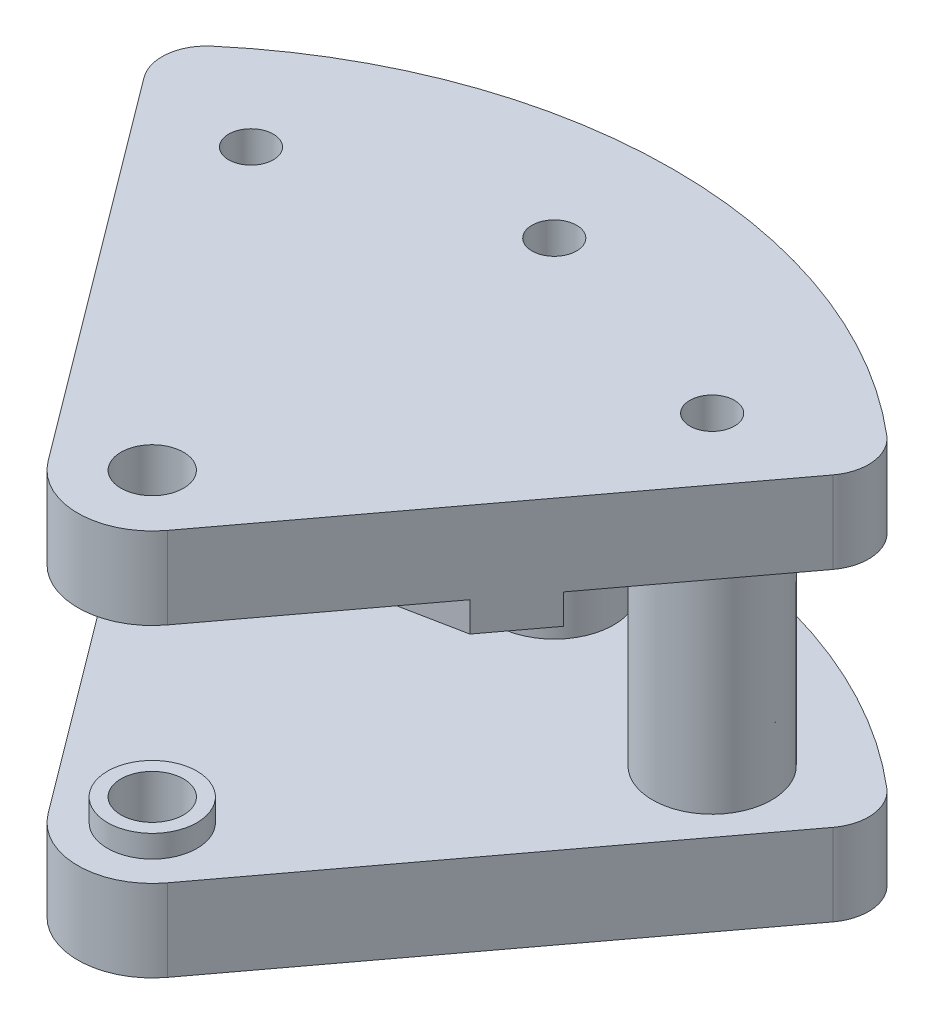
from build123d import *

# Parameters (mm, degrees)
SKETCH_1_R        = 2.1
SKETCH_1_R_2      = 1.5
EXTRUDE_1_DEPTH   = 5.5
SKETCH_2_R        = 3
SKETCH_2_R_2      = 1.5
EXTRUDE_2_DEPTH   = 15
EXTRUDE_2_2_DEPTH = 15
EXTRUDE_2_3_DEPTH = 15
SKETCH_3_R        = 4
SKETCH_3_R_2      = 3.1
EXTRUDE_3_DEPTH   = 14.5
EXTRUDE_3_2_DEPTH = 14.5
EXTRUDE_3_3_DEPTH = 14.5
EXTRUDE_START     = 20.5
SKETCH_1_2_R      = 2.1
SKETCH_1_2_R_2    = 1.5
EXTRUDE_4_DEPTH   = 5.5
SKETCH_4_R        = 3
SKETCH_4_R_2      = 2.1
EXTRUDE_5_DEPTH   = 1.5
EXTRUDE_6_DEPTH   = 2


with BuildPart() as part:
    # ｽｹｯﾁ1 → ﾎﾞｽ - 押し出し1 (new body)
    with BuildSketch(Plane(origin=(0, 0, 0), x_dir=(1, 0, 0), z_dir=(0, 1, 0))):
        with BuildLine():
            Line((-23.129729925, 22.583524826), (-4.004347333, -2.994194789))
            ThreePointArc((-4.004347333, -2.994194789), (0, -5), (4.004347333, -2.994194789))
            Line((4.004347333, -2.994194789), (23.129729925, 22.583524826))
            ThreePointArc((23.129729925, 22.583524826), (23.708299296, 24.715569788), (22.670289168, 26.665670609))
            ThreePointArc((22.670289168, 26.665670609), (0, 35), (-22.670289168, 26.665670609))
            ThreePointArc((-22.670289168, 26.665670609), (-23.708299296, 24.715569788), (-23.129729925, 22.583524826))
        make_face()
        with Locations(Location((0, 0, 0), (0, 0, 270))):
            Circle(SKETCH_1_R, mode=Mode.SUBTRACT)
        with Locations(Location((-15.486563781, 22.117105196, 0), (0, 0, 270))):
            Circle(SKETCH_1_R_2, mode=Mode.SUBTRACT)
        with Locations(Location((15.486563781, 22.117105196, 0), (0, 0, 270))):
            Circle(SKETCH_1_R_2, mode=Mode.SUBTRACT)
        with Locations(Location((0, 27, 0), (0, 0, 270))):
            Circle(SKETCH_1_R_2, mode=Mode.SUBTRACT)
    extrude(amount=EXTRUDE_1_DEPTH)



with BuildPart() as body_2:
    # ｽｹｯﾁ2 → ﾎﾞｽ - 押し出し2 (new body)
    with BuildSketch(Plane(origin=(0, 5.5, 0), x_dir=(1, 0, 0), z_dir=(0, 1, 0))):
        with Locations(Location((0, 27, 0), (0, 0, 270))):
            Circle(SKETCH_2_R)
        with Locations(Location((0, 27, 0), (0, 0, 270))):
            Circle(SKETCH_2_R_2, mode=Mode.SUBTRACT)
    extrude(amount=EXTRUDE_2_DEPTH)



with BuildPart() as body_3:
    # ｽｹｯﾁ2 → Extrude 2 2 (new body)
    with BuildSketch(Plane(origin=(0, 5.5, 0), x_dir=(1, 0, 0), z_dir=(0, 1, 0))):
        with Locations(Location((15.486563781, 22.117105196, 0), (0, 0, 270))):
            Circle(SKETCH_2_R)
        with Locations(Location((15.486563781, 22.117105196, 0), (0, 0, 270))):
            Circle(SKETCH_2_R_2, mode=Mode.SUBTRACT)
    extrude(amount=EXTRUDE_2_2_DEPTH)


with BuildPart() as body_4:
    # ｽｹｯﾁ2 → Extrude 2 3 (new body)
    with BuildSketch(Plane(origin=(0, 5.5, 0), x_dir=(1, 0, 0), z_dir=(0, 1, 0))):
        with Locations(Location((-15.486563781, 22.117105196, 0), (0, 0, 270))):
            Circle(SKETCH_2_R)
        with Locations(Location((-15.486563781, 22.117105196, 0), (0, 0, 270))):
            Circle(SKETCH_2_R_2, mode=Mode.SUBTRACT)
    extrude(amount=EXTRUDE_2_3_DEPTH)


with BuildPart() as body_5:
    # ｽｹｯﾁ3 → ﾎﾞｽ - 押し出し3 (new body)
    with BuildSketch(Plane(origin=(0, 5.5, 0), x_dir=(1, 0, 0), z_dir=(0, 1, 0))):
        with Locations(Location((-15.486563781, 22.117105196, 0), (0, 0, 90))):
            Circle(SKETCH_3_R)
        with Locations(Location((-15.486563781, 22.117105196, 0), (0, 0, 90))):
            Circle(SKETCH_3_R_2, mode=Mode.SUBTRACT)
    extrude(amount=EXTRUDE_3_DEPTH)


with BuildPart() as body_6:
    # ｽｹｯﾁ3 → Extrude 3 2 (new body)
    with BuildSketch(Plane(origin=(0, 5.5, 0), x_dir=(1, 0, 0), z_dir=(0, 1, 0))):
        with Locations(Location((0, 27, 0), (0, 0, 90))):
            Circle(SKETCH_3_R)
        with Locations(Location((0, 27, 0), (0, 0, 90))):
            Circle(SKETCH_3_R_2, mode=Mode.SUBTRACT)
    extrude(amount=EXTRUDE_3_2_DEPTH)


with BuildPart() as body_7:
    # ｽｹｯﾁ3 → Extrude 3 3 (new body)
    with BuildSketch(Plane(origin=(0, 5.5, 0), x_dir=(1, 0, 0), z_dir=(0, 1, 0))):
        with Locations(Location((15.486563781, 22.117105196, 0), (0, 0, 90))):
            Circle(SKETCH_3_R)
        with Locations(Location((15.486563781, 22.117105196, 0), (0, 0, 90))):
            Circle(SKETCH_3_R_2, mode=Mode.SUBTRACT)
    extrude(amount=EXTRUDE_3_3_DEPTH)


with BuildPart() as body_2_1:
    add(body_2.part)

    add(body_3.part)  # ﾎﾞｽ - 押し出し4 merges body 3

    add(body_4.part)  # ﾎﾞｽ - 押し出し4 merges body 4
    # ｽｹｯﾁ1<2> → ﾎﾞｽ - 押し出し4 (add)
    with BuildSketch(Plane(origin=(0, 0, 0), x_dir=(1, 0, 0), z_dir=(0, 1, 0)).offset(EXTRUDE_START)):
        with BuildLine():
            Line((-23.129729925, 22.583524826), (-4.004347333, -2.994194789))
            ThreePointArc((-4.004347333, -2.994194789), (0, -5), (4.004347333, -2.994194789))
            Line((4.004347333, -2.994194789), (23.129729925, 22.583524826))
            ThreePointArc((23.129729925, 22.583524826), (23.708299296, 24.715569788), (22.670289168, 26.665670609))
            ThreePointArc((22.670289168, 26.665670609), (0, 35), (-22.670289168, 26.665670609))
            ThreePointArc((-22.670289168, 26.665670609), (-23.708299296, 24.715569788), (-23.129729925, 22.583524826))
        make_face()
        with Locations(Location((0, 0, 0), (0, 0, 270))):
            Circle(SKETCH_1_2_R, mode=Mode.SUBTRACT)
        with Locations(Location((-15.486563781, 22.117105196, 0), (0, 0, 270))):
            Circle(SKETCH_1_2_R_2, mode=Mode.SUBTRACT)
        with Locations(Location((15.486563781, 22.117105196, 0), (0, 0, 270))):
            Circle(SKETCH_1_2_R_2, mode=Mode.SUBTRACT)
        with Locations(Location((0, 27, 0), (0, 0, 270))):
            Circle(SKETCH_1_2_R_2, mode=Mode.SUBTRACT)
    extrude(amount=EXTRUDE_4_DEPTH)


with BuildPart() as part_1:
    add(part.part)

    add(body_2_1.part)  # ﾎﾞｽ - 押し出し5 merges body 2
    # ｽｹｯﾁ4 → ﾎﾞｽ - 押し出し5 (add)
    with BuildSketch(Plane(origin=(0, 5.5, 0), x_dir=(1, 0, 0), z_dir=(0, 1, 0))):
        with Locations(Location((0, 0, 0), (0, 0, 90))):
            Circle(SKETCH_4_R)
        with Locations(Location((0, 0, 0), (0, 0, 270))):
            Circle(SKETCH_4_R_2, mode=Mode.SUBTRACT)
    extrude(amount=EXTRUDE_5_DEPTH)

    # ｽｹｯﾁ5 → ﾎﾞｽ - 押し出し6 (add)
    with BuildSketch(Plane(origin=(0, 20.5, 0), x_dir=(-1, 0, 0), z_dir=(0, -1, 0))):
        Polygon((-12.699442215, 8.634367298), (9.420495568, 4.249201273), (11.412129463, 6.912753392), (-15.384294553, 12.22500921), align=None)
    extrude(amount=EXTRUDE_6_DEPTH)


solid = Compound([body_5.part, body_6.part, body_7.part, part_1.part])
